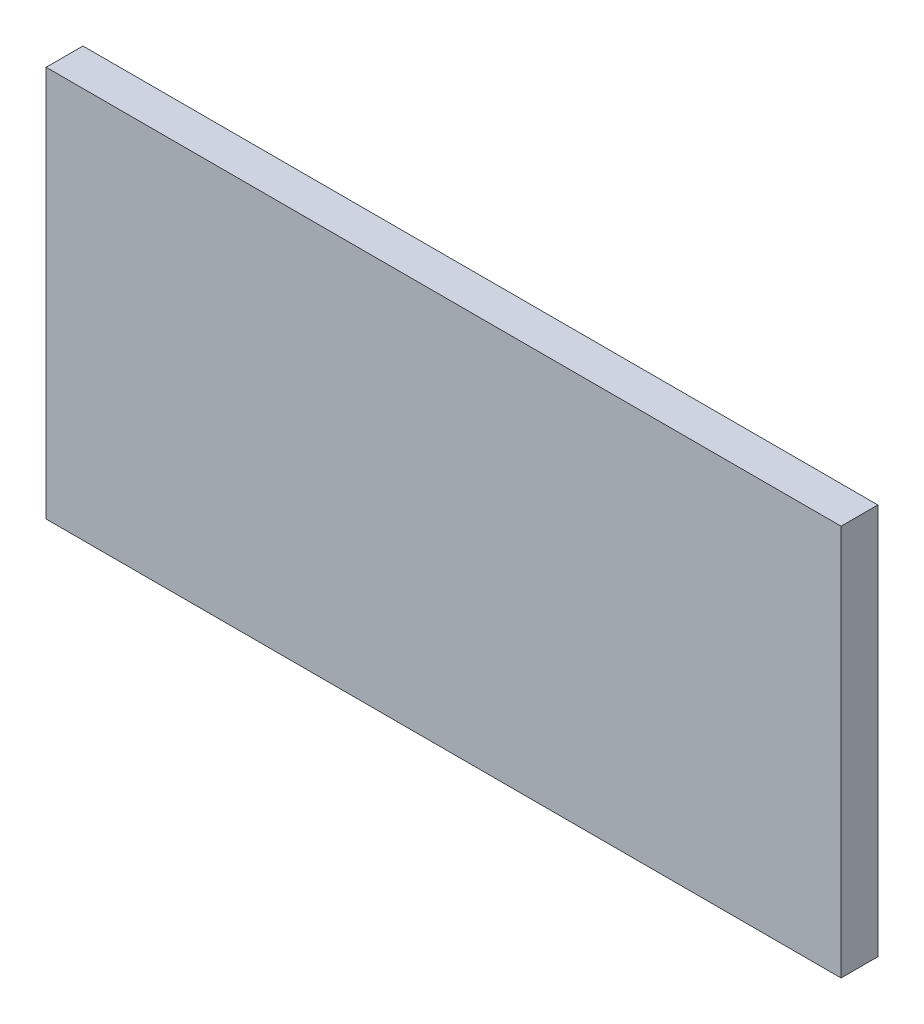
from build123d import *

# Parameters (mm, degrees)
SKETCH1_W           = 215.976715736
SKETCH1_H           = 106.30609137
BOSS_EXTRUDE1_DEPTH = 10


with BuildPart() as part:
    # Sketch1 → Boss-Extrude1 (new body)
    with BuildSketch(Plane.XY):
        Rectangle(SKETCH1_W, SKETCH1_H)
    extrude(amount=BOSS_EXTRUDE1_DEPTH)


solid = part.part
